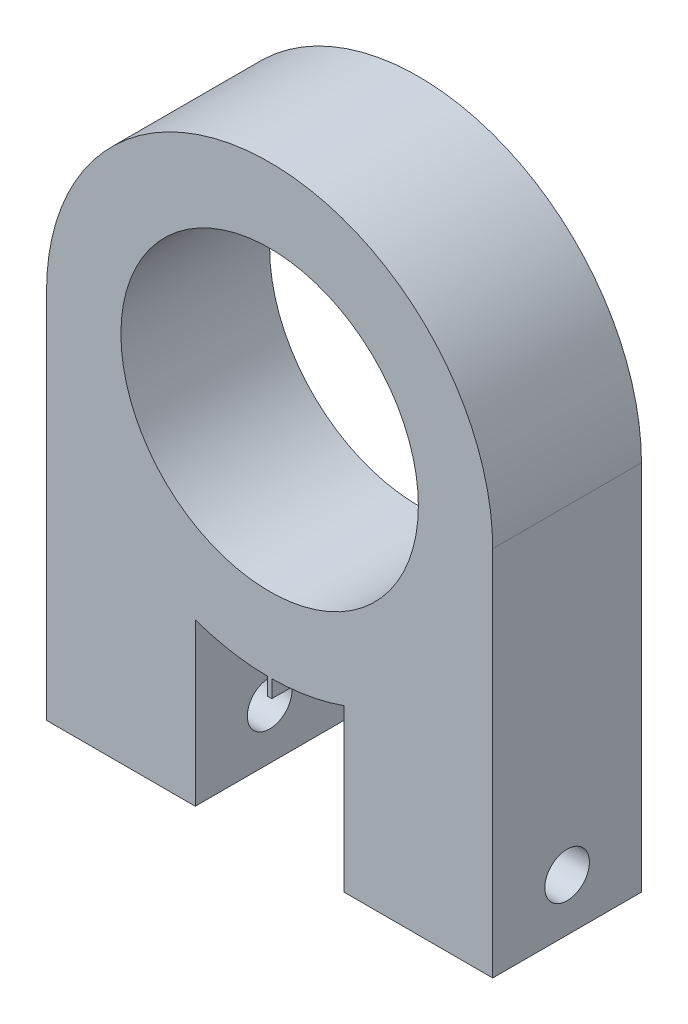
from build123d import *
from build123d.topology import SkipClean

# Parameters (mm, degrees)
ESQUISSE1_R             = 15
ESQUISSE1_R_2           = 10
BOSS_EXTRU_1_DEPTH      = 10
BOSS_EXTRU_2_START      = -10
ESQUISSE2_W             = 0.284758048
ESQUISSE2_H             = 1.526135502
BOSS_EXTRU_2_DEPTH      = 10
ESQUISSE3_R             = 1.5
ENL_V_MAT_EXTRU_1_DEPTH = 41.311288741


with BuildPart() as part:
    # Esquisse1 → Boss.-Extru.1 (new body)
    with BuildSketch(Plane.XY):
        Circle(ESQUISSE1_R)
        Circle(ESQUISSE1_R_2, mode=Mode.SUBTRACT)
    extrude(amount=BOSS_EXTRU_1_DEPTH)

    # Esquisse2 → Boss.-Extru.2 (add)
    with SkipClean():  # the faces are left unmerged after this step: merging them gives an invalid solid
        with BuildSketch(Plane.XY.offset(10).offset(BOSS_EXTRU_2_START)):
            with BuildLine():
                Line((15, 0), (15, -25))
                Line((15, -25), (5, -25))
                Line((5, -25), (5, -8.660254038))
                ThreePointArc((5, -8.660254038), (8.660254038, -5), (10, 0))
                Line((10, 0), (15, 0))
            make_face()
            with Locations((0, -15.401311239)):
                Rectangle(ESQUISSE2_W, ESQUISSE2_H)
            with BuildLine():
                Line((-10, 0), (-15, 0))
                Line((-15, 0), (-15, -25))
                Line((-15, -25), (-5, -25))
                Line((-5, -25), (-5, -8.660254038))
                ThreePointArc((-5, -8.660254038), (-8.660254038, -5), (-10, 0))
            make_face()
        extrude(amount=BOSS_EXTRU_2_DEPTH)

    # Esquisse3 → Enlèv. mat.-Extru.1 (cut, through all)
    with SkipClean():  # the faces are left unmerged after this step: merging them gives an invalid solid
        with BuildSketch(Plane.ZY.offset(15)):
            with Locations(Location((5, -21.5, 0), (0, 0, 270))):
                Circle(ESQUISSE3_R)
        extrude(amount=-ENL_V_MAT_EXTRU_1_DEPTH, mode=Mode.SUBTRACT)


solid = part.part
